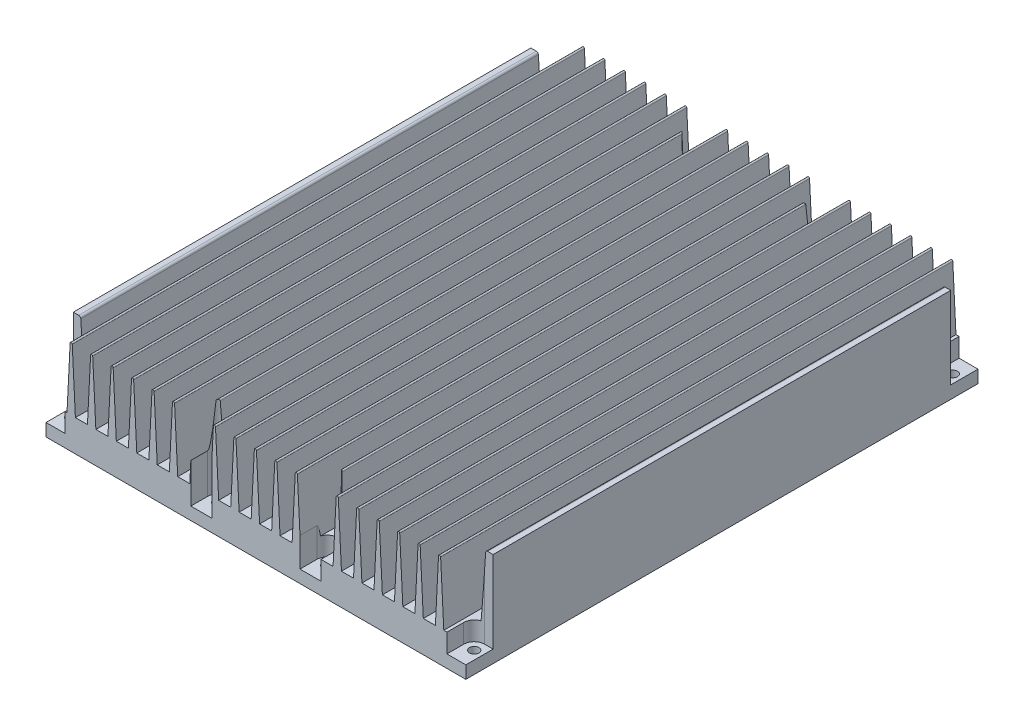
from build123d import *

# Parameters (mm, degrees)
EXTRUDE_1_DEPTH       = 244
EXTRUDE_3_DEPTH       = 244
PATTERN_CURVE_1_COUNT = 19
PATTERN_CURVE_1_PITCH = 9.75
SKETCH_3_R            = 2.25
CUT_EXTRUDE_1_DEPTH   = 50
CUT_EXTRUDE_3_DEPTH   = 80
SKETCH_8_R            = 1.6
SKETCH_8_R_2          = 1.3
CUT_EXTRUDE_4_DEPTH   = 10
SKETCH_10_R           = 2.6
SKETCH_10_R_2         = 1.6
CUT_EXTRUDE_5_DEPTH   = 6
SKETCH_12_R           = 2.1
SKETCH_12_R_2         = 1.6
CUT_EXTRUDE_6_DEPTH   = 10


with BuildPart() as part:
    # Эскиз1 → Вытянуть1 (new body)
    with BuildSketch(Plane.XY):
        with BuildLine():
            Line((0, 45), (2.564446908, 45))
            ThreePointArc((2.564446908, 45), (3.247630994, 44.730246195), (3.562232066, 44.066519011))
            Line((3.562232066, 44.066519011), (5.5, 15))
            Line((5.5, 15), (194.5, 15))
            Line((194.5, 15), (196.437767934, 44.066519011))
            ThreePointArc((196.437767934, 44.066519011), (196.752369006, 44.730246195), (197.435553092, 45))
            Line((197.435553092, 45), (200, 45))
            Line((200, 45), (200, 0))
            Line((200, 0), (0, 0))
            Line((0, 0), (0, 45))
        make_face()
    extrude(amount=EXTRUDE_1_DEPTH)

    # Эскиз2 → Вытянуть3 (add)
    with BuildSketch(Plane.XY.offset(244)):
        with BuildLine():
            Line((11.5, 44.5), (10, 15))
            Line((10, 15), (14, 15))
            Line((14, 15), (12.5, 44.5))
            ThreePointArc((12.5, 44.5), (12, 45), (11.5, 44.5))
        make_face()
    extrude_3 = extrude(amount=-EXTRUDE_3_DEPTH)

    # Кривая1: Вытянуть3 ×19
    with Locations(*[(i * PATTERN_CURVE_1_PITCH, 0, 0) for i in range(1, PATTERN_CURVE_1_COUNT)]):
        add(extrude_3)

    # Эскиз3 → Вырез-Вытянуть1 (cut)
    with BuildSketch(Plane.XZ):
        with Locations((4, 236)):
            Circle(SKETCH_3_R)
        with Locations((74, 236)):
            Circle(SKETCH_3_R)
        with Locations(Location((74, 8, 0), (0, 0, 131.810314896))):
            Circle(SKETCH_3_R)
        with Locations(Location((4, 8, 0), (0, 0, 311.810314896))):
            Circle(SKETCH_3_R)
        with Locations((196, 8)):
            Circle(SKETCH_3_R)
        with Locations((126, 8)):
            Circle(SKETCH_3_R)
        with Locations(Location((126, 236, 0), (0, 0, 63.612200039))):
            Circle(SKETCH_3_R)
        with Locations(Location((196, 236, 0), (0, 0, 309.644601439))):
            Circle(SKETCH_3_R)
    extrude(amount=-CUT_EXTRUDE_1_DEPTH, mode=Mode.SUBTRACT)

    # Эскиз6 → Вырез-Вытянуть3 (cut)
    with BuildSketch(Plane.XZ.offset(-6)):
        with BuildLine():
            Line((9, 236), (9, 247.625328498))
            Line((9, 247.625328498), (-6.127764857, 247.625328498))
            Line((-6.127764857, 247.625328498), (-6.127764857, 231))
            Line((-6.127764857, 231), (4, 231))
            ThreePointArc((4, 231), (7.535533906, 232.464466094), (9, 236))
        make_face()
        with BuildLine():
            Line((69, 236), (69, 248.983105869))
            Line((69, 248.983105869), (79, 248.983105869))
            Line((79, 248.983105869), (79, 236))
            ThreePointArc((79, 236), (74, 231), (69, 236))
        make_face()
        with BuildLine():
            Line((121, 248.983105869), (121, 236))
            ThreePointArc((121, 236), (126, 231), (131, 236))
            Line((131, 236), (131, 248.983105869))
            Line((131, 248.983105869), (121, 248.983105869))
        make_face()
        with BuildLine():
            Line((206.127764857, 247.625328498), (191, 247.625328498))
            Line((191, 247.625328498), (191, 236))
            ThreePointArc((191, 236), (192.464466094, 232.464466094), (196, 231))
            Line((196, 231), (206.127764857, 231))
            Line((206.127764857, 231), (206.127764857, 247.625328498))
        make_face()
        with BuildLine():
            Line((191, 8), (191, -3.625328498))
            Line((191, -3.625328498), (206.127764857, -3.625328498))
            Line((206.127764857, -3.625328498), (206.127764857, 13))
            Line((206.127764857, 13), (196, 13))
            ThreePointArc((196, 13), (192.464466094, 11.535533906), (191, 8))
        make_face()
        with BuildLine():
            Line((131, 8), (131, -4.983105869))
            Line((131, -4.983105869), (121, -4.983105869))
            Line((121, -4.983105869), (121, 8))
            ThreePointArc((121, 8), (126, 13), (131, 8))
        make_face()
        with BuildLine():
            Line((79, -4.983105869), (79, 8))
            ThreePointArc((79, 8), (74, 13), (69, 8))
            Line((69, 8), (69, -4.983105869))
            Line((69, -4.983105869), (79, -4.983105869))
        make_face()
        with BuildLine():
            Line((-6.127764857, -3.625328498), (9, -3.625328498))
            Line((9, -3.625328498), (9, 8))
            ThreePointArc((9, 8), (7.535533906, 11.535533906), (4, 13))
            Line((4, 13), (-6.127764857, 13))
            Line((-6.127764857, 13), (-6.127764857, -3.625328498))
        make_face()
    extrude(amount=-CUT_EXTRUDE_3_DEPTH, mode=Mode.SUBTRACT)

    # Эскиз8 → Вырез-Вытянуть4 (cut)
    with BuildSketch(Plane(origin=(133.240090243, 0, 310.149074448), x_dir=(-1, 0, 0), z_dir=(0, -1, 0))):
        with Locations(Location((93.240090243, 92.149074448, 0), (0, 0, 180))):
            Circle(SKETCH_8_R)
        with Locations(Location((93.240090243, 227.149074448, 0), (0, 0, 180))):
            Circle(SKETCH_8_R)
        with Locations(Location((53.490090243, 223.549074448, 0), (0, 0, 180))):
            Circle(SKETCH_8_R)
        with Locations(Location((53.490090243, 139.749074448, 0), (0, 0, 180))):
            Circle(SKETCH_8_R)
        with Locations(Location((56.240090243, 100.649074448, 0), (0, 0, 180))):
            Circle(SKETCH_8_R_2)
        with Locations(Location((113.240090243, 285.149074448, 0), (0, 0, 180))):
            Circle(SKETCH_8_R)
        with Locations(Location((113.240090243, 237.149074448, 0), (0, 0, 180))):
            Circle(SKETCH_8_R)
        with Locations(Location((47.240090243, 237.149074448, 0), (0, 0, 180))):
            Circle(SKETCH_8_R)
        with Locations(Location((47.240090243, 285.149074448, 0), (0, 0, 180))):
            Circle(SKETCH_8_R)
    extrude(amount=-CUT_EXTRUDE_4_DEPTH, mode=Mode.SUBTRACT)

    # Эскиз10 → Вырез-Вытянуть5 (cut)
    with BuildSketch(Plane(origin=(-5.723570629, 0, -26.359021189), x_dir=(1, 0, 0), z_dir=(0, -1, 0))):
        with Locations((139.223570629, 207.359021189)):
            Circle(SKETCH_10_R)
        with Locations((165.723570629, 244.359021189)):
            Circle(SKETCH_10_R_2)
        with Locations((165.723570629, 109.359021189)):
            Circle(SKETCH_10_R_2)
        with Locations((125.473570629, 196.759021189)):
            Circle(SKETCH_10_R_2)
        with Locations((125.473570629, 112.959021189)):
            Circle(SKETCH_10_R_2)
    extrude(amount=-CUT_EXTRUDE_5_DEPTH, mode=Mode.SUBTRACT)

    # Эскиз12 → Вырез-Вытянуть6 (cut)
    with BuildSketch(Plane(origin=(193.647525499, 0, 525.672067887), x_dir=(-1, 0, 0), z_dir=(0, -1, 0))):
        with Locations(Location((10.647525499, 425.672067887, 0), (0, 0, 180))):
            Circle(SKETCH_12_R)
        with Locations((18.647525499, 500.672067887)):
            Circle(SKETCH_12_R_2)
        with Locations((78.647525499, 500.672067887)):
            Circle(SKETCH_12_R_2)
        with Locations(Location((78.647525499, 465.672067887, 0), (0, 0, 180))):
            Circle(SKETCH_12_R_2)
        with Locations(Location((18.647525499, 465.672067887, 0), (0, 0, 180))):
            Circle(SKETCH_12_R_2)
    extrude(amount=-CUT_EXTRUDE_6_DEPTH, mode=Mode.SUBTRACT)


solid = part.part
